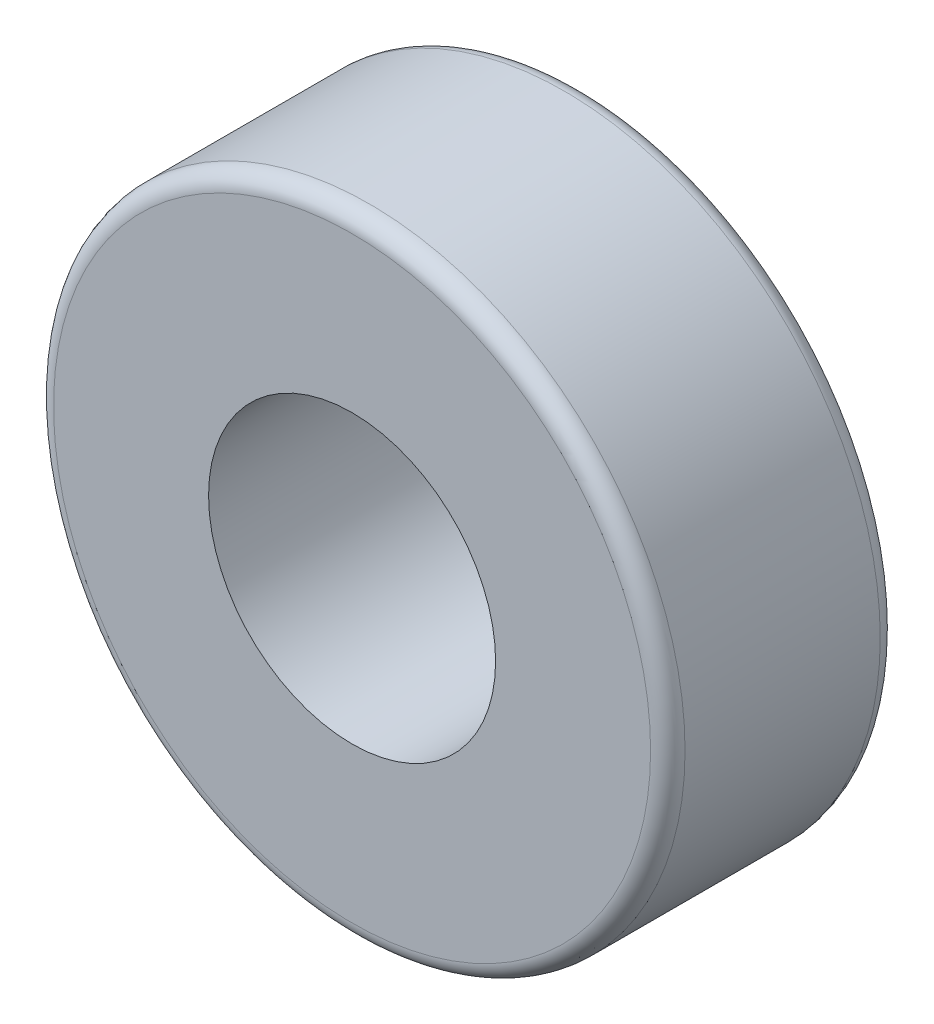
from build123d import *

# Parameters (mm, degrees)
SKETCH1_R           = 5.5
SKETCH1_R_2         = 2.5
BOSS_EXTRUDE1_DEPTH = 2
FILLET2_R           = 0.3


with BuildPart() as part:
    # Sketch1 → Boss-Extrude1 (new, symmetric)
    with BuildSketch(Plane.XY):
        Circle(SKETCH1_R)
        Circle(SKETCH1_R_2, mode=Mode.SUBTRACT)
    extrude(amount=BOSS_EXTRUDE1_DEPTH, both=True)

    # Fillet2
    fillet2_edges = [part.edges().sort_by_distance(p)[0] for p in [
        (-5.5, 0, -2),
        (-5.5, 0, 2),
        (-2.5, 0, -2),
    ]]
    fillet(fillet2_edges, radius=FILLET2_R)


solid = part.part
